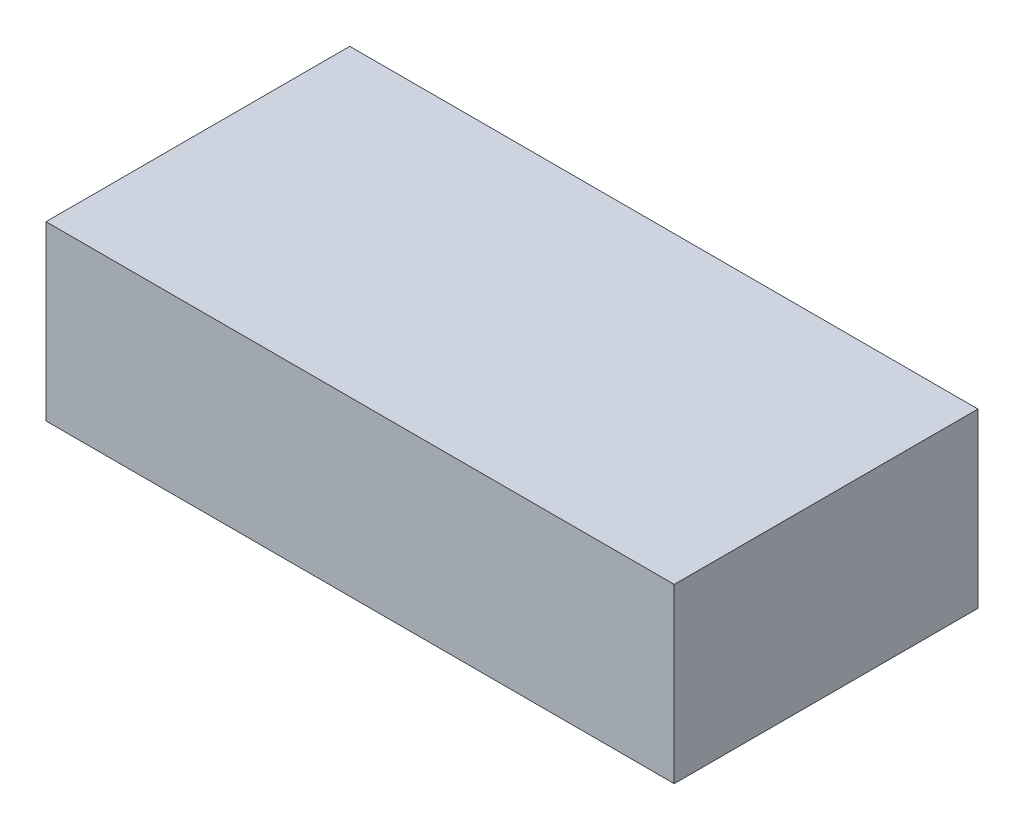
from build123d import *

# Parameters (mm, degrees)
SKETCH1_W           = 18.2
SKETCH1_H           = 5
BOSS_EXTRUDE1_DEPTH = 8.8


with BuildPart() as part:
    # Sketch1 → Boss-Extrude1 (new body)
    with BuildSketch(Plane.XY):
        with Locations((-21.358183077, 16.161608687)):
            Rectangle(SKETCH1_W, SKETCH1_H)
    extrude(amount=BOSS_EXTRUDE1_DEPTH)


solid = part.part
